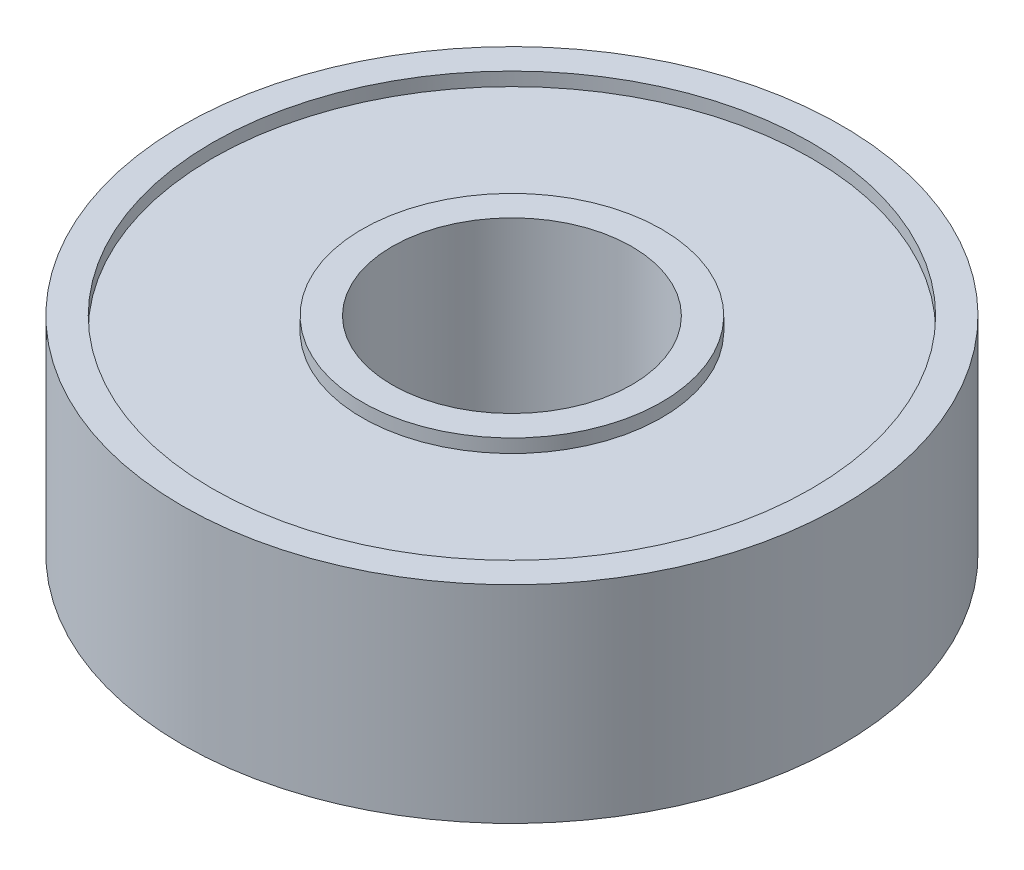
from build123d import *

# Parameters (mm, degrees)
SKETCH1_R           = 11
BOSS_EXTRUDE1_DEPTH = 3
SKETCH2_R           = 11
SKETCH2_R_2         = 10
BOSS_EXTRUDE2_DEPTH = 3.45
SKETCH4_R           = 5
BOSS_EXTRUDE3_DEPTH = 3.45
SKETCH5_R           = 4
CUT_EXTRUDE1_DEPTH  = 10


with BuildPart() as part:
    # Sketch1 → Boss-Extrude1 (new, symmetric)
    with BuildSketch(Plane(origin=(0, 0, 0), x_dir=(1, 0, 0), z_dir=(0, 1, 0))):
        with Locations(Location((0, 0, 0), (0, 0, 270))):
            Circle(SKETCH1_R)
    extrude(amount=BOSS_EXTRUDE1_DEPTH, both=True)

    # Sketch2 → Boss-Extrude2 (add, symmetric)
    with BuildSketch(Plane(origin=(0, 0, 0), x_dir=(1, 0, 0), z_dir=(0, 1, 0))):
        with Locations(Location((0, 0, 0), (0, 0, 270))):
            Circle(SKETCH2_R)
        with Locations(Location((0, 0, 0), (0, 0, 90))):
            Circle(SKETCH2_R_2, mode=Mode.SUBTRACT)
    extrude(amount=BOSS_EXTRUDE2_DEPTH, both=True)

    # Sketch4 → Boss-Extrude3 (add, symmetric)
    with BuildSketch(Plane(origin=(0, 0, 0), x_dir=(1, 0, 0), z_dir=(0, 1, 0))):
        with Locations(Location((0, 0, 0), (0, 0, 90))):
            Circle(SKETCH4_R)
    extrude(amount=BOSS_EXTRUDE3_DEPTH, both=True)

    # Sketch5 → Cut-Extrude1 (cut)
    with BuildSketch(Plane(origin=(0, 3.45, 0), x_dir=(1, 0, 0), z_dir=(0, 1, 0))):
        with Locations(Location((0, 0, 0), (0, 0, 270))):
            Circle(SKETCH5_R)
    extrude(amount=-CUT_EXTRUDE1_DEPTH, mode=Mode.SUBTRACT)


solid = part.part
